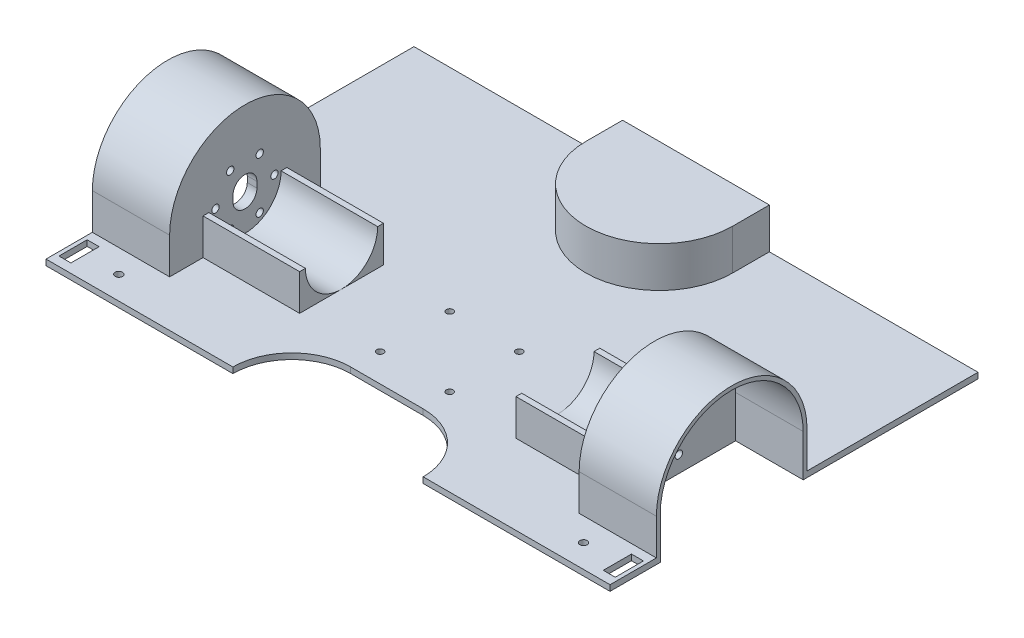
from build123d import *

# Parameters (mm, degrees)
SKETCH2_W           = 292
SKETCH2_H           = 160
BOSS_EXTRUDE1_DEPTH = 3
BOSS_EXTRUDE2_DEPTH = 3
BOSS_EXTRUDE3_START = -35
BOSS_EXTRUDE3_DEPTH = 55
SKETCH5_R           = 1.9
BOSS_EXTRUDE4_DEPTH = 5
BOSS_EXTRUDE5_START = 35
BOSS_EXTRUDE5_DEPTH = 35
SKETCH5_5_R         = 1.9
CUT_EXTRUDE1_DEPTH  = 309.76121842
SKETCH6_R           = 1.9
SKETCH6_W           = 6.2
SKETCH6_H           = 14.6
CUT_EXTRUDE2_DEPTH  = 225.15461182
SKETCH7_R           = 1.75
CUT_EXTRUDE3_DEPTH  = 225.15461182
BOSS_EXTRUDE6_DEPTH = 3
BOSS_EXTRUDE7_DEPTH = 21
SKETCH8_3_W         = 32
SKETCH8_3_H         = 38
CUT_EXTRUDE4_DEPTH  = 221.209195993


with BuildPart() as part:
    # Sketch2 → Boss-Extrude1 (new body)
    with BuildSketch(Plane(origin=(0, 0, 0), x_dir=(1, 0, 0), z_dir=(0, 1, 0))):
        with Locations((0, 80)):
            Rectangle(SKETCH2_W, SKETCH2_H)
    extrude(amount=BOSS_EXTRUDE1_DEPTH)

    # Sketch3 → Boss-Extrude2 (add)
    with BuildSketch(Plane(origin=(0, 3, 0), x_dir=(1, 0, 0), z_dir=(0, 1, 0))):
        with BuildLine():
            ThreePointArc((-49.25, -30.5), (-40.316756826, -8.933243174), (-18.75, 0))
            Line((-18.75, 0), (-146, 0))
            Line((-146, 0), (-146, -30.5))
            Line((-146, -30.5), (-49.25, -30.5))
        make_face()
        with BuildLine():
            Line((146, -30.5), (146, 0))
            Line((146, 0), (18.75, 0))
            ThreePointArc((18.75, 0), (40.316756826, -8.933243174), (49.25, -30.5))
            Line((49.25, -30.5), (146, -30.5))
        make_face()
    extrude(amount=-BOSS_EXTRUDE2_DEPTH)

    # Sketch4 → Boss-Extrude3 (add)
    with BuildSketch(Plane(origin=(146, 0, 0), x_dir=(0, 0, -1), z_dir=(1, 0, 0)).offset(BOSS_EXTRUDE3_START)):
        with BuildLine():
            Line((10.8, 21.7), (10.8, 3))
            Line((10.8, 3), (32.499999845, 3))
            ThreePointArc((32.499999845, 3), (19.277103137, 8.477103246), (13.8, 21.7))
            Line((13.8, 21.7), (10.8, 21.7))
        make_face()
        with BuildLine():
            ThreePointArc((51.2, 21.7), (45.722896754, 8.477103137), (32.499999845, 3))
            Line((32.499999845, 3), (54.2, 3))
            Line((54.2, 3), (54.2, 21.7))
            Line((54.2, 21.7), (51.2, 21.7))
        make_face()
    boss_extrude3 = extrude(amount=-BOSS_EXTRUDE3_DEPTH)

    # Sketch5 → Boss-Extrude4 (add)
    # profile 1 of 3: a face of its own
    with BuildSketch(Plane(origin=(111, 0, 0), x_dir=(0, 0, -1), z_dir=(1, 0, 0))):
        with BuildLine():
            Line((-4.5, 21.7), (-4.5, 0))
            Line((-4.5, 0), (69.5, 0))
            Line((69.5, 0), (69.5, 21.7))
            ThreePointArc((69.5, 21.7), (32.5, 58.7), (-4.5, 21.7))
        make_face()
        with Locations((24.875, 8.493112592)):
            Circle(SKETCH5_R, mode=Mode.SUBTRACT)
        with Locations((17.25, 21.7)):
            Circle(SKETCH5_R, mode=Mode.SUBTRACT)
        with Locations((40.125, 8.493112592)):
            Circle(SKETCH5_R, mode=Mode.SUBTRACT)
        with BuildLine():
            ThreePointArc((32.5, 3), (45.722896808, 8.477103192), (51.2, 21.7))
            Line((51.2, 21.7), (54.2, 21.7))
            Line((54.2, 21.7), (54.2, 3))
            Line((54.2, 3), (32.5, 3))
        make_face(mode=Mode.SUBTRACT)
        with BuildLine():
            ThreePointArc((26.3, 23.2), (32.5, 29.4), (38.7, 23.2))
            Line((38.7, 23.2), (38.7, 20.2))
            ThreePointArc((38.7, 20.2), (32.5, 14), (26.3, 20.2))
            Line((26.3, 20.2), (26.3, 23.2))
        make_face(mode=Mode.SUBTRACT)
        with Locations((47.75, 21.7)):
            Circle(SKETCH5_R, mode=Mode.SUBTRACT)
        with Locations((24.875, 34.906887408)):
            Circle(SKETCH5_R, mode=Mode.SUBTRACT)
        with Locations((40.125, 34.906887408)):
            Circle(SKETCH5_R, mode=Mode.SUBTRACT)
    # profile 2 of 3: a face of its own
    with BuildSketch(Plane(origin=(111, 0, 0), x_dir=(0, 0, -1), z_dir=(1, 0, 0))):
        with BuildLine():
            Line((-6.5, 0), (-4.5, 0))
            Line((-4.5, 0), (-4.5, 21.7))
            ThreePointArc((-4.5, 21.7), (32.5, 58.7), (69.5, 21.7))
            Line((69.5, 21.7), (69.5, 0))
            Line((69.5, 0), (71.5, 0))
            Line((71.5, 0), (71.5, 21.7))
            ThreePointArc((71.5, 21.7), (32.5, 60.7), (-6.5, 21.7))
            Line((-6.5, 21.7), (-6.5, 0))
        make_face()
    # profile 3 of 3: a face of its own
    with BuildSketch(Plane(origin=(111, 0, 0), x_dir=(0, 0, -1), z_dir=(1, 0, 0))):
        with BuildLine():
            Line((54.2, 21.7), (51.2, 21.7))
            ThreePointArc((51.2, 21.7), (45.722896808, 8.477103192), (32.5, 3))
            Line((32.5, 3), (54.2, 3))
            Line((54.2, 3), (54.2, 21.7))
        make_face()
    boss_extrude4 = extrude(amount=-BOSS_EXTRUDE4_DEPTH)

    # Sketch5<4> → Boss-Extrude5 (add)
    with BuildSketch(Plane(origin=(111, 0, 0), x_dir=(0, 0, -1), z_dir=(1, 0, 0)).offset(BOSS_EXTRUDE5_START)):
        with BuildLine():
            Line((-6.5, 0), (-4.5, 0))
            Line((-4.5, 0), (-4.5, 21.7))
            ThreePointArc((-4.5, 21.7), (32.5, 58.7), (69.5, 21.7))
            Line((69.5, 21.7), (69.5, 0))
            Line((69.5, 0), (71.5, 0))
            Line((71.5, 0), (71.5, 21.7))
            ThreePointArc((71.5, 21.7), (32.5, 60.7), (-6.5, 21.7))
            Line((-6.5, 21.7), (-6.5, 0))
        make_face()
    boss_extrude5 = extrude(amount=-BOSS_EXTRUDE5_DEPTH)

    # Sketch5<5> → Cut-Extrude1 (cut, through all)
    # profile 1 of 2: a face of its own
    with BuildSketch(Plane(origin=(111, 0, 0), x_dir=(0, 0, -1), z_dir=(1, 0, 0))):
        with BuildLine():
            Line((-4.5, 21.7), (-4.5, 0))
            Line((-4.5, 0), (69.5, 0))
            Line((69.5, 0), (69.5, 21.7))
            ThreePointArc((69.5, 21.7), (32.5, 58.7), (-4.5, 21.7))
        make_face()
        with Locations((24.875, 8.493112592)):
            Circle(SKETCH5_5_R, mode=Mode.SUBTRACT)
        with Locations((17.25, 21.7)):
            Circle(SKETCH5_5_R, mode=Mode.SUBTRACT)
        with Locations((40.125, 8.493112592)):
            Circle(SKETCH5_5_R, mode=Mode.SUBTRACT)
        with BuildLine():
            ThreePointArc((32.5, 3), (45.722896808, 8.477103192), (51.2, 21.7))
            Line((51.2, 21.7), (54.2, 21.7))
            Line((54.2, 21.7), (54.2, 3))
            Line((54.2, 3), (32.5, 3))
        make_face(mode=Mode.SUBTRACT)
        with BuildLine():
            ThreePointArc((26.3, 23.2), (32.5, 29.4), (38.7, 23.2))
            Line((38.7, 23.2), (38.7, 20.2))
            ThreePointArc((38.7, 20.2), (32.5, 14), (26.3, 20.2))
            Line((26.3, 20.2), (26.3, 23.2))
        make_face(mode=Mode.SUBTRACT)
        with Locations((47.75, 21.7)):
            Circle(SKETCH5_5_R, mode=Mode.SUBTRACT)
        with Locations((24.875, 34.906887408)):
            Circle(SKETCH5_5_R, mode=Mode.SUBTRACT)
        with Locations((40.125, 34.906887408)):
            Circle(SKETCH5_5_R, mode=Mode.SUBTRACT)
    # profile 2 of 2: a face of its own
    with BuildSketch(Plane(origin=(111, 0, 0), x_dir=(0, 0, -1), z_dir=(1, 0, 0))):
        with BuildLine():
            Line((54.2, 21.7), (51.2, 21.7))
            ThreePointArc((51.2, 21.7), (45.722896808, 8.477103192), (32.5, 3))
            Line((32.5, 3), (54.2, 3))
            Line((54.2, 3), (54.2, 21.7))
        make_face()
    cut_extrude1 = extrude(amount=CUT_EXTRUDE1_DEPTH, mode=Mode.SUBTRACT)

    # Sketch6 → Cut-Extrude2 (cut, through all)
    with BuildSketch(Plane(origin=(0, 3, 0), x_dir=(1, 0, 0), z_dir=(0, 1, 0))):
        with Locations(Location((120.3, -18.5, 0), (0, 0, 270))):
            Circle(SKETCH6_R)
        with Locations((140.9, -18.5)):
            Rectangle(SKETCH6_W, SKETCH6_H)
    cut_extrude2 = extrude(amount=-CUT_EXTRUDE2_DEPTH, mode=Mode.SUBTRACT)

    # Mirror1: Boss-Extrude3, Boss-Extrude4, Boss-Extrude5, Cut-Extrude1, Cut-Extrude2 across plane
    add(boss_extrude3.mirror(Plane(origin=(0, 0, 0), x_dir=(0, 0, 1), z_dir=(1, 0, 0))))
    add(boss_extrude4.mirror(Plane(origin=(0, 0, 0), x_dir=(0, 0, 1), z_dir=(1, 0, 0))))
    add(boss_extrude5.mirror(Plane(origin=(0, 0, 0), x_dir=(0, 0, 1), z_dir=(1, 0, 0))))
    add(cut_extrude1.mirror(Plane(origin=(0, 0, 0), x_dir=(0, 0, 1), z_dir=(1, 0, 0))), mode=Mode.SUBTRACT)
    add(cut_extrude2.mirror(Plane(origin=(0, 0, 0), x_dir=(0, 0, 1), z_dir=(1, 0, 0))), mode=Mode.SUBTRACT)

    # Sketch7 → Cut-Extrude3 (cut, through all)
    with BuildSketch(Plane(origin=(0, 3, 0), x_dir=(1, 0, 0), z_dir=(0, 1, 0))):
        with Locations(Location((-18, 14.5, 0), (0, 0, 270))):
            Circle(SKETCH7_R)
        with Locations(Location((18, 14.5, 0), (0, 0, 270))):
            Circle(SKETCH7_R)
        with Locations(Location((18, 50.5, 0), (0, 0, 270))):
            Circle(SKETCH7_R)
        with Locations(Location((-18, 50.5, 0), (0, 0, 270))):
            Circle(SKETCH7_R)
    extrude(amount=-CUT_EXTRUDE3_DEPTH, mode=Mode.SUBTRACT)



with BuildPart() as body_2:
    # Sketch8 → Boss-Extrude6 (new body)
    with BuildSketch(Plane(origin=(0, 21, 0), x_dir=(1, 0, 0), z_dir=(0, 1, 0))):
        with BuildLine():
            Line((-35, 141), (-35, 160))
            Line((-35, 160), (35, 160))
            Line((35, 160), (35, 141))
            ThreePointArc((35, 141), (0, 106), (-35, 141))
        make_face()
    extrude(amount=BOSS_EXTRUDE6_DEPTH)


with BuildPart() as part_1:
    add(part.part)

    add(body_2.part)  # Boss-Extrude7 merges body 2
    # Sketch10 → Boss-Extrude7 (add)
    with BuildSketch(Plane(origin=(0, 24, 0), x_dir=(1, 0, 0), z_dir=(0, 1, 0))):
        with BuildLine():
            Line((-38, 160), (-38, 141))
            ThreePointArc((-38, 141), (0, 103), (38, 141))
            Line((38, 141), (38, 160))
            Line((38, 160), (35, 160))
            Line((35, 160), (35, 141))
            ThreePointArc((35, 141), (0, 106), (-35, 141))
            Line((-35, 141), (-35, 160))
            Line((-35, 160), (-38, 160))
        make_face()
    extrude(amount=-BOSS_EXTRUDE7_DEPTH)

    # Sketch8<3> → Cut-Extrude4 (cut, through all)
    with BuildSketch(Plane(origin=(0, 21, 0), x_dir=(1, 0, 0), z_dir=(0, 1, 0))):
        with Locations((0, 141)):
            Rectangle(SKETCH8_3_W, SKETCH8_3_H)
        with BuildLine():
            Line((-16, 122), (-16, 160))
            Line((-16, 160), (-35, 160))
            Line((-35, 160), (-35, 141))
            ThreePointArc((-35, 141), (0, 106), (35, 141))
            Line((35, 141), (35, 160))
            Line((35, 160), (16, 160))
            Line((16, 160), (16, 122))
            Line((16, 122), (-16, 122))
        make_face()
    extrude(amount=-CUT_EXTRUDE4_DEPTH, mode=Mode.SUBTRACT)


solid = part_1.part
